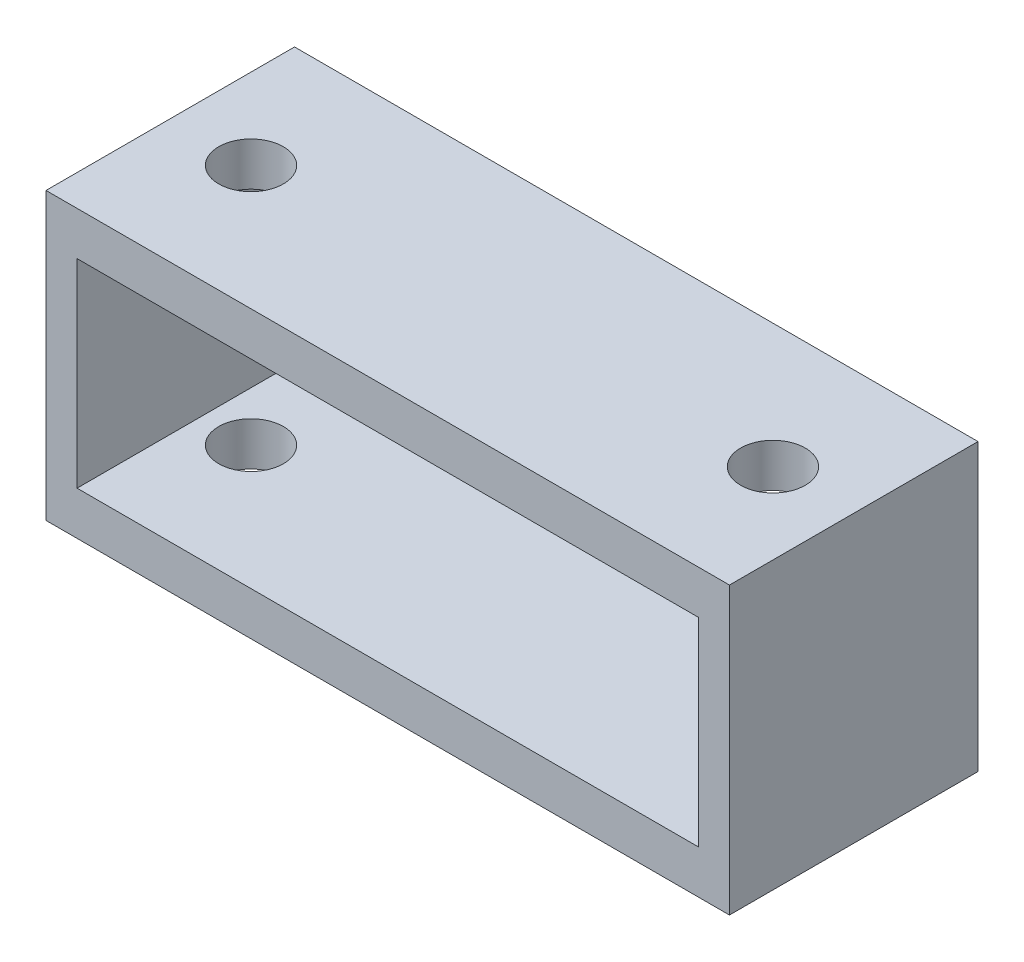
from build123d import *

# Parameters (mm, degrees)
SKETCH_1_W          = 55
SKETCH_1_H          = 20
EXTRUDE_1_DEPTH     = 23
CUT_EXTRUDE_1_REACH = 43.052
SKETCH_2_W          = 50
SKETCH_2_H          = 16
CUT_EXTRUDE_2_REACH = 39.219
SKETCH_3_R          = 2.6


with BuildPart() as part:
    # 草图1 → 凸台-拉伸1 (new body)
    with BuildSketch(Plane(origin=(0, 0, 0), x_dir=(1, 0, 0), z_dir=(0, 1, 0))):
        Rectangle(SKETCH_1_W, SKETCH_1_H)
    extrude(amount=EXTRUDE_1_DEPTH)

    # 草图2 → 切除-拉伸1 (cut, up to next)
    with BuildSketch(Plane.XY.offset(10), mode=Mode.PRIVATE) as cut_extrude_1_sk1:
        with Locations((0, 11.5)):
            Rectangle(SKETCH_2_W, SKETCH_2_H)
    cut_extrude_1_tool1 = extrude(cut_extrude_1_sk1.sketch, amount=-CUT_EXTRUDE_1_REACH, mode=Mode.PRIVATE) & part.part
    add(cut_extrude_1_tool1.solids().sort_by_distance((0, 11.5, 10))[0], mode=Mode.SUBTRACT)

    # 切除-拉伸2: up to this face of the body (flat: up to its plane)
    cut_extrude_2_end = Plane(part.part.faces().sort_by_distance((0, 0, 0))[0])
    # 草图3 → 切除-拉伸2 (cut, up to the picked face)
    with BuildSketch(Plane(origin=(0, 23, 0), x_dir=(1, 0, 0), z_dir=(0, 1, 0)), mode=Mode.PRIVATE) as cut_extrude_2_sk1:
        with Locations(Location((-21, 0, 0), (0, 0, 270))):
            Circle(SKETCH_3_R)
    cut_extrude_2_tool1 = split(extrude(cut_extrude_2_sk1.sketch, amount=-CUT_EXTRUDE_2_REACH, mode=Mode.PRIVATE), bisect_by=cut_extrude_2_end, keep=Keep.BOTH, mode=Mode.PRIVATE)
    # 草图3 → 切除-拉伸2 (cut, up to the picked face)
    with BuildSketch(Plane(origin=(0, 23, 0), x_dir=(1, 0, 0), z_dir=(0, 1, 0)), mode=Mode.PRIVATE) as cut_extrude_2_sk2:
        with Locations(Location((21, 0, 0), (0, 0, 270))):
            Circle(SKETCH_3_R)
    cut_extrude_2_tool2 = split(extrude(cut_extrude_2_sk2.sketch, amount=-CUT_EXTRUDE_2_REACH, mode=Mode.PRIVATE), bisect_by=cut_extrude_2_end, keep=Keep.BOTH, mode=Mode.PRIVATE)
    add(cut_extrude_2_tool1.solids().sort_by(Axis((-21, 23, 0), (0, -1, 0)))[0], mode=Mode.SUBTRACT)
    add(cut_extrude_2_tool2.solids().sort_by(Axis((21, 23, 0), (0, -1, 0)))[0], mode=Mode.SUBTRACT)


solid = part.part
